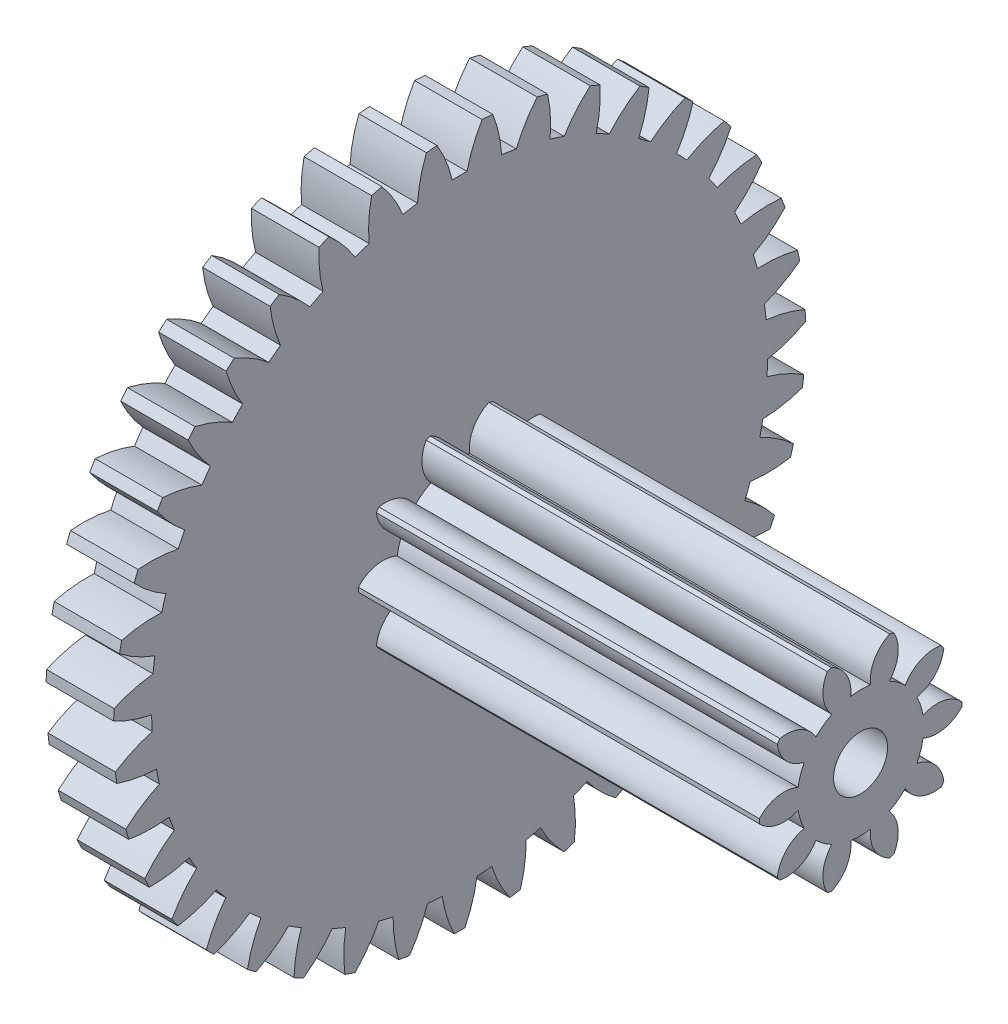
from build123d import *

# Parameters (mm, degrees)
ESQUISSE1_W                     = 1
ESQUISSE1_H                     = 5.125
ENL_V_MAT_EXTRU_1_DEPTH         = 8.316505313
ENL_V_MAT_EXTRU_2_DEPTH         = 8.316505313
ENL_V_MAT_EXTRU_3_DEPTH         = 8.316505313
ENL_V_MAT_EXTRU_4_DEPTH         = 8.316505313
ENL_V_MAT_EXTRU_5_DEPTH         = 8.316505313
ENL_V_MAT_EXTRU_6_DEPTH         = 8.316505313
ENL_V_MAT_EXTRU_7_DEPTH         = 8.316505313
ENL_V_MAT_EXTRU_8_DEPTH         = 8.316505313
ENL_V_MAT_EXTRU_9_DEPTH         = 8.316505313
ENL_V_MAT_EXTRU_10_DEPTH        = 8.316505313
ENL_V_MAT_EXTRU_11_DEPTH        = 8.316505313
ENL_V_MAT_EXTRU_12_DEPTH        = 8.316505313
ENL_V_MAT_EXTRU_13_DEPTH        = 8.316505313
ENL_V_MAT_EXTRU_14_DEPTH        = 8.316505313
ENL_V_MAT_EXTRU_15_DEPTH        = 8.316505313
ENL_V_MAT_EXTRU_16_DEPTH        = 8.316505313
ENL_V_MAT_EXTRU_17_DEPTH        = 8.316505313
ENL_V_MAT_EXTRU_18_DEPTH        = 8.316505313
ENL_V_MAT_EXTRU_19_DEPTH        = 8.316505313
ENL_V_MAT_EXTRU_20_DEPTH        = 8.316505313
ENL_V_MAT_EXTRU_21_DEPTH        = 8.316505313
ENL_V_MAT_EXTRU_22_DEPTH        = 8.316505313
ENL_V_MAT_EXTRU_23_DEPTH        = 8.316505313
ENL_V_MAT_EXTRU_24_DEPTH        = 8.316505313
ENL_V_MAT_EXTRU_25_DEPTH        = 8.316505313
ENL_V_MAT_EXTRU_26_DEPTH        = 8.316505313
ENL_V_MAT_EXTRU_27_DEPTH        = 8.316505313
ENL_V_MAT_EXTRU_28_DEPTH        = 8.316505313
ENL_V_MAT_EXTRU_29_DEPTH        = 8.316505313
ENL_V_MAT_EXTRU_30_DEPTH        = 8.316505313
ENL_V_MAT_EXTRU_31_DEPTH        = 8.316505313
ENL_V_MAT_EXTRU_32_DEPTH        = 8.315404959
ENL_V_MAT_EXTRU_33_DEPTH        = 8.315404959
ENL_V_MAT_EXTRU_34_DEPTH        = 8.315404959
ENL_V_MAT_EXTRU_35_DEPTH        = 8.315404959
ENL_V_MAT_EXTRU_36_DEPTH        = 8.315404959
ENL_V_MAT_EXTRU_37_DEPTH        = 8.315404959
ENL_V_MAT_EXTRU_38_DEPTH        = 8.315404959
ENL_V_MAT_EXTRU_39_DEPTH        = 8.315404959
BOSS_EXTRU_1_DEPTH              = 5.938524524
DIAM_TRE_DU_PER_AGE_0_8_0_8_1_D = 0.8


with BuildPart() as part:
    # Esquisse1 → Révolution1 (revolve)
    with BuildSketch(Plane(origin=(0, 0, 0), x_dir=(-1, 0, 0), z_dir=(0, 0, -1)), mode=Mode.PRIVATE) as r_volution1_sk:
        with Locations((-0.5, 2.5625)):
            Rectangle(ESQUISSE1_W, ESQUISSE1_H)
    revolve(r_volution1_sk.sketch.rotate(Axis((1, 0, 0), (-1, 0, 0)), 270), axis=Axis((1, 0, 0), (-1, 0, 0)))

    # Esquisse2 → Enlèv. mat.-Extru.1 (cut, through all)
    with BuildSketch(Plane.ZY):
        with BuildLine():
            ThreePointArc((-0.491599352, 5.101367961), (-0.822107814, 5.058632596), (-1.149140058, 4.994507196))
            ThreePointArc((-1.149140058, 4.994507196), (-0.974871828, 4.75090918), (-0.839964848, 4.483496549))
            ThreePointArc((-0.839964848, 4.483496549), (-0.731716058, 4.502429773), (-0.623042589, 4.518749847))
            ThreePointArc((-0.623042589, 4.518749847), (-0.579759423, 4.815121196), (-0.491599352, 5.101367961))
        make_face()
    extrude(amount=-ENL_V_MAT_EXTRU_1_DEPTH, mode=Mode.SUBTRACT)

    # Esquisse3 → Enlèv. mat.-Extru.2 (cut, through all)
    with BuildSketch(Plane.ZY):
        with BuildLine():
            ThreePointArc((0.3330837, 5.114164668), (0, 5.125), (-0.3330837, 5.114164668))
            ThreePointArc((-0.3330837, 5.114164668), (-0.200148067, 4.845766593), (-0.1098841, 4.560176283))
            ThreePointArc((-0.1098841, 4.560176283), (0, 4.5615), (0.1098841, 4.560176283))
            ThreePointArc((0.1098841, 4.560176283), (0.200148067, 4.845766593), (0.3330837, 5.114164668))
        make_face()
    extrude(amount=-ENL_V_MAT_EXTRU_2_DEPTH, mode=Mode.SUBTRACT)

    # Esquisse4 → Enlèv. mat.-Extru.3 (cut, through all)
    with BuildSketch(Plane.ZY):
        with BuildLine():
            ThreePointArc((1.149140058, 4.994507196), (0.822107814, 5.058632596), (0.491599352, 5.101367961))
            ThreePointArc((0.491599352, 5.101367961), (0.579759423, 4.815121196), (0.623042589, 4.518749847))
            ThreePointArc((0.623042589, 4.518749847), (0.731716058, 4.502429773), (0.839964848, 4.483496549))
            ThreePointArc((0.839964848, 4.483496549), (0.974871828, 4.75090918), (1.149140058, 4.994507196))
        make_face()
    extrude(amount=-ENL_V_MAT_EXTRU_3_DEPTH, mode=Mode.SUBTRACT)

    # Esquisse5 → Enlèv. mat.-Extru.4 (cut, through all)
    with BuildSketch(Plane.ZY):
        with BuildLine():
            ThreePointArc((1.935434293, 4.745494611), (1.622923468, 4.861249265), (1.303550238, 4.956448504))
            ThreePointArc((1.303550238, 4.956448504), (1.34465145, 4.65976669), (1.339832802, 4.360290164))
            ThreePointArc((1.339832802, 4.360290164), (1.444481054, 4.32674898), (1.548290948, 4.290696609))
            ThreePointArc((1.548290948, 4.290696609), (1.724346921, 4.533005716), (1.935434293, 4.745494611))
        make_face()
    extrude(amount=-ENL_V_MAT_EXTRU_4_DEPTH, mode=Mode.SUBTRACT)

    # Esquisse6 → Enlèv. mat.-Extru.5 (cut, through all)
    with BuildSketch(Plane.ZY):
        with BuildLine():
            ThreePointArc((2.671601796, 4.373576208), (2.381706257, 4.537962131), (2.081739858, 4.683159635))
            ThreePointArc((2.081739858, 4.683159635), (2.07471771, 4.383726673), (2.021922049, 4.088901256))
            ThreePointArc((2.021922049, 4.088901256), (2.119834749, 4.039007661), (2.216517126, 3.986769881))
            ThreePointArc((2.216517126, 3.986769881), (2.429162334, 4.197699784), (2.671601796, 4.373576208))
        make_face()
    extrude(amount=-ENL_V_MAT_EXTRU_5_DEPTH, mode=Mode.SUBTRACT)

    # Esquisse7 → Enlèv. mat.-Extru.6 (cut, through all)
    with BuildSketch(Plane.ZY):
        with BuildLine():
            ThreePointArc((3.338576216, 3.888384478), (3.078804104, 4.097144162), (2.806013509, 4.28857939))
            ThreePointArc((2.806013509, 4.28857939), (2.751049871, 3.994150439), (2.651644577, 3.711611952))
            ThreePointArc((2.651644577, 3.711611952), (2.740285838, 3.646658165), (2.827336674, 3.579587907))
            ThreePointArc((2.827336674, 3.579587907), (3.071063719, 3.753675633), (3.338576216, 3.888384478))
        make_face()
    extrude(amount=-ENL_V_MAT_EXTRU_6_DEPTH, mode=Mode.SUBTRACT)

    # Esquisse8 → Enlèv. mat.-Extru.7 (cut, through all)
    with BuildSketch(Plane.ZY):
        with BuildLine():
            ThreePointArc((3.919083265, 3.302485634), (3.696162543, 3.550212312), (3.457612884, 3.782927193))
            ThreePointArc((3.457612884, 3.782927193), (3.356131286, 3.501127806), (3.212690904, 3.23819385))
            ThreePointArc((3.212690904, 3.23819385), (3.289764964, 3.159862139), (3.364929688, 3.079696486))
            ThreePointArc((3.364929688, 3.079696486), (3.633426167, 3.212433254), (3.919083265, 3.302485634))
        make_face()
    extrude(amount=-ENL_V_MAT_EXTRU_7_DEPTH, mode=Mode.SUBTRACT)

    # Esquisse9 → Enlèv. mat.-Extru.8 (cut, through all)
    with BuildSketch(Plane.ZY):
        with BuildLine():
            ThreePointArc((4.398088117, 2.631054146), (4.217792313, 2.911331827), (4.019661902, 3.179299168))
            ThreePointArc((4.019661902, 3.179299168), (3.874290663, 2.917427803), (3.690530223, 2.680908227))
            ThreePointArc((3.690530223, 2.680908227), (3.754040904, 2.591227342), (3.81537279, 2.500042544))
            ThreePointArc((3.81537279, 2.500042544), (4.101684785, 2.587990542), (4.398088117, 2.631054146))
        make_face()
    extrude(amount=-ENL_V_MAT_EXTRU_8_DEPTH, mode=Mode.SUBTRACT)

    # Esquisse10 → Enlèv. mat.-Extru.9 (cut, through all)
    with BuildSketch(Plane.ZY):
        with BuildLine():
            ThreePointArc((4.763184796, 1.891479738), (4.630183477, 2.197049377), (4.477603787, 2.493328964))
            ThreePointArc((4.477603787, 2.493328964), (4.292107947, 2.258167951), (4.072786749, 2.054188489))
            ThreePointArc((4.072786749, 2.054188489), (4.121089157, 1.955481119), (4.166999741, 1.855638814))
            ThreePointArc((4.166999741, 1.855638814), (4.463711922, 1.896520234), (4.763184796, 1.891479738))
        make_face()
    extrude(amount=-ENL_V_MAT_EXTRU_9_DEPTH, mode=Mode.SUBTRACT)

    # Esquisse11 → Enlèv. mat.-Extru.10 (cut, through all)
    with BuildSketch(Plane.ZY):
        with BuildLine():
            ThreePointArc((5.004917491, 1.102916998), (4.922655322, 1.425864503), (4.819578087, 1.74278285))
            ThreePointArc((4.819578087, 1.74278285), (4.59876189, 1.540422736), (4.349560237, 1.374266349))
            ThreePointArc((4.349560237, 1.374266349), (4.381403366, 1.269088962), (4.410703588, 1.163175012))
            ThreePointArc((4.410703588, 1.163175012), (4.710131265, 1.155931048), (5.004917491, 1.102916998))
        make_face()
    extrude(amount=-ENL_V_MAT_EXTRU_10_DEPTH, mode=Mode.SUBTRACT)

    # Esquisse12 → Enlèv. mat.-Extru.11 (cut, through all)
    with BuildSketch(Plane.ZY):
        with BuildLine():
            ThreePointArc((5.117025453, 0.285789287), (5.08763298, 0.617750486), (5.036727846, 0.947099576))
            ThreePointArc((5.036727846, 0.947099576), (4.786310315, 0.782781381), (4.513682399, 0.658751432))
            ThreePointArc((4.513682399, 0.658751432), (4.528241529, 0.549828067), (4.540172528, 0.440585589))
            ThreePointArc((4.540172528, 0.440585589), (4.834560682, 0.385403856), (5.117025453, 0.285789287))
        make_face()
    extrude(amount=-ENL_V_MAT_EXTRU_11_DEPTH, mode=Mode.SUBTRACT)

    # Esquisse13 → Enlèv. mat.-Extru.12 (cut, through all)
    with BuildSketch(Plane.ZY):
        with BuildLine():
            ThreePointArc((5.096605143, -0.538740217), (5.120843616, -0.206362943), (5.123428999, 0.12688692))
            ThreePointArc((5.123428999, 0.12688692), (4.849895818, 0.0048664), (4.560902559, -0.073824801))
            ThreePointArc((4.560902559, -0.073824801), (4.557800615, -0.183673086), (4.552053385, -0.293414769))
            ThreePointArc((4.552053385, -0.293414769), (4.833777517, -0.395105094), (5.096605143, -0.538740217))
        make_face()
    extrude(amount=-ENL_V_MAT_EXTRU_12_DEPTH, mode=Mode.SUBTRACT)

    # Esquisse14 → Enlèv. mat.-Extru.13 (cut, through all)
    with BuildSketch(Plane.ZY):
        with BuildLine():
            ThreePointArc((4.944185436, -1.349316631), (5.021427092, -1.025131681), (5.077436033, -0.69661204))
            ThreePointArc((5.077436033, -0.69661204), (4.787871566, -0.773174619), (4.489997737, -0.804489011))
            ThreePointArc((4.489997737, -0.804489011), (4.469315059, -0.912417202), (4.446038451, -1.019815839))
            ThreePointArc((4.446038451, -1.019815839), (4.707802054, -1.16538103), (4.944185436, -1.349316631))
        make_face()
    extrude(amount=-ENL_V_MAT_EXTRU_13_DEPTH, mode=Mode.SUBTRACT)

    # Esquisse15 → Enlèv. mat.-Extru.14 (cut, through all)
    with BuildSketch(Plane.ZY):
        with BuildLine():
            ThreePointArc((4.663713924, -2.124946454), (4.791958244, -1.817350046), (4.89994014, -1.502069115))
            ThreePointArc((4.89994014, -1.502069115), (4.601843956, -1.531190821), (4.302804333, -1.514317378))
            ThreePointArc((4.302804333, -1.514317378), (4.265076591, -1.617530192), (4.224873456, -1.719804214))
            ThreePointArc((4.224873456, -1.719804214), (4.45989699, -1.905474209), (4.663713924, -2.124946454))
        make_face()
    extrude(amount=-ENL_V_MAT_EXTRU_14_DEPTH, mode=Mode.SUBTRACT)

    # Esquisse16 → Enlèv. mat.-Extru.15 (cut, through all)
    with BuildSketch(Plane.ZY):
        with BuildLine():
            ThreePointArc((4.262454672, -2.845541279), (4.438380194, -2.5625), (4.595538371, -2.268623388))
            ThreePointArc((4.595538371, -2.268623388), (4.296631004, -2.249549986), (4.004170557, -2.18492572))
            ThreePointArc((4.004170557, -2.18492572), (3.950374879, -2.28075), (3.894286457, -2.375250564))
            ThreePointArc((3.894286457, -2.375250564), (4.096482937, -2.596216607), (4.262454672, -2.845541279))
        make_face()
    extrude(amount=-ENL_V_MAT_EXTRU_15_DEPTH, mode=Mode.SUBTRACT)

    # Esquisse17 → Enlèv. mat.-Extru.16 (cut, through all)
    with BuildSketch(Plane.ZY):
        with BuildLine():
            ThreePointArc((3.750800082, -3.492438081), (3.969850429, -3.24128255), (4.172114573, -2.976421508))
            ThreePointArc((4.172114573, -2.976421508), (3.880137567, -2.909646987), (3.601830867, -2.798945633))
            ThreePointArc((3.601830867, -2.798945633), (3.533360533, -2.884899581), (3.462839485, -2.969179171))
            ThreePointArc((3.462839485, -2.969179171), (3.626972127, -3.219718359), (3.750800082, -3.492438081))
        make_face()
    extrude(amount=-ENL_V_MAT_EXTRU_16_DEPTH, mode=Mode.SUBTRACT)

    # Esquisse18 → Enlèv. mat.-Extru.17 (cut, through all)
    with BuildSketch(Plane.ZY):
        with BuildLine():
            ThreePointArc((3.14200174, -4.04888257), (3.398503623, -3.836117584), (3.640635198, -3.607131873))
            ThreePointArc((3.640635198, -3.607131873), (3.363150604, -3.49438566), (3.106205649, -3.340474325))
            ThreePointArc((3.106205649, -3.340474325), (3.024834006, -3.414331778), (2.941706789, -3.486207598))
            ThreePointArc((2.941706789, -3.486207598), (3.063524645, -3.759831097), (3.14200174, -4.04888257))
        make_face()
    extrude(amount=-ENL_V_MAT_EXTRU_17_DEPTH, mode=Mode.SUBTRACT)

    # Esquisse19 → Enlèv. mat.-Extru.18 (cut, through all)
    with BuildSketch(Plane.ZY):
        with BuildLine():
            ThreePointArc((2.451827203, -4.500463128), (2.739137359, -4.331599188), (3.014865285, -4.144419418))
            ThreePointArc((3.014865285, -4.144419418), (2.759059808, -3.988621579), (2.530131336, -3.795486487))
            ThreePointArc((2.530131336, -3.795486487), (2.437965866, -3.855334575), (2.344385433, -3.912945079))
            ThreePointArc((2.344385433, -3.912945079), (2.420733483, -4.202566184), (2.451827203, -4.500463128))
        make_face()
    extrude(amount=-ENL_V_MAT_EXTRU_18_DEPTH, mode=Mode.SUBTRACT)

    # Esquisse20 → Enlèv. mat.-Extru.19 (cut, through all)
    with BuildSketch(Plane.ZY):
        with BuildLine():
            ThreePointArc((1.69815163, -4.835484054), (2.008828876, -4.714894649), (2.311011944, -4.574368677))
            ThreePointArc((2.311011944, -4.574368677), (2.083510811, -4.379554295), (1.888527951, -4.152197542))
            ThreePointArc((1.888527951, -4.152197542), (1.787955691, -4.196486232), (1.686345725, -4.238339338))
            ThreePointArc((1.686345725, -4.238339338), (1.715246596, -4.536457014), (1.69815163, -4.835484054))
        make_face()
    extrude(amount=-ENL_V_MAT_EXTRU_19_DEPTH, mode=Mode.SUBTRACT)

    # Esquisse21 → Enlèv. mat.-Extru.20 (cut, through all)
    with BuildSketch(Plane.ZY):
        with BuildLine():
            ThreePointArc((0.900494822, -5.045268484), (1.226492779, -4.976076814), (1.547304608, -4.88584419))
            ThreePointArc((1.547304608, -4.88584419), (1.35399998, -4.657058855), (1.198012684, -4.401368862))
            ThreePointArc((1.198012684, -4.401368862), (1.091638403, -4.4289511), (0.984630549, -4.453962835))
            ThreePointArc((0.984630549, -4.453962835), (0.965335723, -4.75285599), (0.900494822, -5.045268484))
        make_face()
    extrude(amount=-ENL_V_MAT_EXTRU_20_DEPTH, mode=Mode.SUBTRACT)

    # Esquisse22 → Enlèv. mat.-Extru.21 (cut, through all)
    with BuildSketch(Plane.ZY):
        with BuildLine():
            ThreePointArc((0.079515671, -5.12438311), (0.412391165, -5.108381204), (0.743522895, -5.070778905))
            ThreePointArc((0.743522895, -5.070778905), (0.589421259, -4.813948037), (0.476469518, -4.53654704))
            ThreePointArc((0.476469518, -4.53654704), (0.367048253, -4.546708461), (0.257413959, -4.554231033))
            ThreePointArc((0.257413959, -4.554231033), (0.190423162, -4.846158493), (0.079515671, -5.12438311))
        make_face()
    extrude(amount=-ENL_V_MAT_EXTRU_21_DEPTH, mode=Mode.SUBTRACT)

    # Esquisse23 → Enlèv. mat.-Extru.22 (cut, through all)
    with BuildSketch(Plane.ZY):
        with BuildLine():
            ThreePointArc((-0.743522895, -5.070778905), (-0.412391165, -5.108381204), (-0.079515671, -5.12438311))
            ThreePointArc((-0.079515671, -5.12438311), (-0.190423162, -4.846158493), (-0.257413959, -4.554231033))
            ThreePointArc((-0.257413959, -4.554231033), (-0.367048253, -4.546708461), (-0.476469518, -4.53654704))
            ThreePointArc((-0.476469518, -4.53654704), (-0.589421259, -4.813948037), (-0.743522895, -5.070778905))
        make_face()
    extrude(amount=-ENL_V_MAT_EXTRU_22_DEPTH, mode=Mode.SUBTRACT)

    # Esquisse24 → Enlèv. mat.-Extru.23 (cut, through all)
    with BuildSketch(Plane.ZY):
        with BuildLine():
            ThreePointArc((-1.547304608, -4.88584419), (-1.226492779, -4.976076814), (-0.900494822, -5.045268484))
            ThreePointArc((-0.900494822, -5.045268484), (-0.965335723, -4.75285599), (-0.984630549, -4.453962835))
            ThreePointArc((-0.984630549, -4.453962835), (-1.091638403, -4.4289511), (-1.198012684, -4.401368862))
            ThreePointArc((-1.198012684, -4.401368862), (-1.35399998, -4.657058855), (-1.547304608, -4.88584419))
        make_face()
    extrude(amount=-ENL_V_MAT_EXTRU_23_DEPTH, mode=Mode.SUBTRACT)

    # Esquisse25 → Enlèv. mat.-Extru.24 (cut, through all)
    with BuildSketch(Plane.ZY):
        with BuildLine():
            ThreePointArc((-2.311011944, -4.574368677), (-2.008828876, -4.714894649), (-1.69815163, -4.835484054))
            ThreePointArc((-1.69815163, -4.835484054), (-1.715246596, -4.536457014), (-1.686345725, -4.238339338))
            ThreePointArc((-1.686345725, -4.238339338), (-1.787955691, -4.196486232), (-1.888527951, -4.152197542))
            ThreePointArc((-1.888527951, -4.152197542), (-2.083510811, -4.379554295), (-2.311011944, -4.574368677))
        make_face()
    extrude(amount=-ENL_V_MAT_EXTRU_24_DEPTH, mode=Mode.SUBTRACT)

    # Esquisse26 → Enlèv. mat.-Extru.25 (cut, through all)
    with BuildSketch(Plane.ZY):
        with BuildLine():
            ThreePointArc((-3.014865285, -4.144419418), (-2.739137359, -4.331599188), (-2.451827203, -4.500463128))
            ThreePointArc((-2.451827203, -4.500463128), (-2.420733483, -4.202566184), (-2.344385433, -3.912945079))
            ThreePointArc((-2.344385433, -3.912945079), (-2.437965866, -3.855334575), (-2.530131336, -3.795486487))
            ThreePointArc((-2.530131336, -3.795486487), (-2.759059808, -3.988621579), (-3.014865285, -4.144419418))
        make_face()
    extrude(amount=-ENL_V_MAT_EXTRU_25_DEPTH, mode=Mode.SUBTRACT)

    # Esquisse27 → Enlèv. mat.-Extru.26 (cut, through all)
    with BuildSketch(Plane.ZY):
        with BuildLine():
            ThreePointArc((-3.640635198, -3.607131873), (-3.398503623, -3.836117584), (-3.14200174, -4.04888257))
            ThreePointArc((-3.14200174, -4.04888257), (-3.063524645, -3.759831097), (-2.941706789, -3.486207598))
            ThreePointArc((-2.941706789, -3.486207598), (-3.024834006, -3.414331778), (-3.106205649, -3.340474325))
            ThreePointArc((-3.106205649, -3.340474325), (-3.363150604, -3.49438566), (-3.640635198, -3.607131873))
        make_face()
    extrude(amount=-ENL_V_MAT_EXTRU_26_DEPTH, mode=Mode.SUBTRACT)

    # Esquisse28 → Enlèv. mat.-Extru.27 (cut, through all)
    with BuildSketch(Plane.ZY):
        with BuildLine():
            ThreePointArc((-4.172114573, -2.976421508), (-3.969850429, -3.24128255), (-3.750800082, -3.492438081))
            ThreePointArc((-3.750800082, -3.492438081), (-3.626972127, -3.219718359), (-3.462839485, -2.969179171))
            ThreePointArc((-3.462839485, -2.969179171), (-3.533360533, -2.884899581), (-3.601830867, -2.798945633))
            ThreePointArc((-3.601830867, -2.798945633), (-3.880137567, -2.909646987), (-4.172114573, -2.976421508))
        make_face()
    extrude(amount=-ENL_V_MAT_EXTRU_27_DEPTH, mode=Mode.SUBTRACT)

    # Esquisse29 → Enlèv. mat.-Extru.28 (cut, through all)
    with BuildSketch(Plane.ZY):
        with BuildLine():
            ThreePointArc((-4.595538371, -2.268623388), (-4.438380194, -2.5625), (-4.262454672, -2.845541279))
            ThreePointArc((-4.262454672, -2.845541279), (-4.096482937, -2.596216607), (-3.894286457, -2.375250564))
            ThreePointArc((-3.894286457, -2.375250564), (-3.950374879, -2.28075), (-4.004170557, -2.18492572))
            ThreePointArc((-4.004170557, -2.18492572), (-4.296631004, -2.249549986), (-4.595538371, -2.268623388))
        make_face()
    extrude(amount=-ENL_V_MAT_EXTRU_28_DEPTH, mode=Mode.SUBTRACT)

    # Esquisse30 → Enlèv. mat.-Extru.29 (cut, through all)
    with BuildSketch(Plane.ZY):
        with BuildLine():
            ThreePointArc((-4.89994014, -1.502069115), (-4.791958244, -1.817350046), (-4.663713924, -2.124946454))
            ThreePointArc((-4.663713924, -2.124946454), (-4.45989699, -1.905474209), (-4.224873456, -1.719804214))
            ThreePointArc((-4.224873456, -1.719804214), (-4.265076591, -1.617530192), (-4.302804333, -1.514317378))
            ThreePointArc((-4.302804333, -1.514317378), (-4.601843956, -1.531190821), (-4.89994014, -1.502069115))
        make_face()
    extrude(amount=-ENL_V_MAT_EXTRU_29_DEPTH, mode=Mode.SUBTRACT)

    # Esquisse31 → Enlèv. mat.-Extru.30 (cut, through all)
    with BuildSketch(Plane.ZY):
        with BuildLine():
            ThreePointArc((-5.077436033, -0.69661204), (-5.021427092, -1.025131681), (-4.944185436, -1.349316631))
            ThreePointArc((-4.944185436, -1.349316631), (-4.707802054, -1.16538103), (-4.446038451, -1.019815839))
            ThreePointArc((-4.446038451, -1.019815839), (-4.469315059, -0.912417202), (-4.489997737, -0.804489011))
            ThreePointArc((-4.489997737, -0.804489011), (-4.787871566, -0.773174619), (-5.077436033, -0.69661204))
        make_face()
    extrude(amount=-ENL_V_MAT_EXTRU_30_DEPTH, mode=Mode.SUBTRACT)

    # Esquisse32 → Enlèv. mat.-Extru.31 (cut, through all)
    with BuildSketch(Plane.ZY):
        with BuildLine():
            ThreePointArc((-5.123428999, 0.12688692), (-5.120843616, -0.206362943), (-5.096605143, -0.538740217))
            ThreePointArc((-5.096605143, -0.538740217), (-4.833777517, -0.395105094), (-4.552053385, -0.293414769))
            ThreePointArc((-4.552053385, -0.293414769), (-4.557800615, -0.183673086), (-4.560902559, -0.073824801))
            ThreePointArc((-4.560902559, -0.073824801), (-4.849895818, 0.0048664), (-5.123428999, 0.12688692))
        make_face()
    extrude(amount=-ENL_V_MAT_EXTRU_31_DEPTH, mode=Mode.SUBTRACT)

    # Esquisse33 → Enlèv. mat.-Extru.32 (cut, through all)
    with BuildSketch(Plane.ZY):
        with BuildLine():
            ThreePointArc((-5.036727846, 0.947099576), (-5.08763298, 0.617750486), (-5.117025453, 0.285789287))
            ThreePointArc((-5.117025453, 0.285789287), (-4.834560682, 0.385403856), (-4.540172528, 0.440585589))
            ThreePointArc((-4.540172528, 0.440585589), (-4.528241529, 0.549828067), (-4.513682399, 0.658751432))
            ThreePointArc((-4.513682399, 0.658751432), (-4.786310315, 0.782781381), (-5.036727846, 0.947099576))
        make_face()
    extrude(amount=-ENL_V_MAT_EXTRU_32_DEPTH, mode=Mode.SUBTRACT)

    # Esquisse34 → Enlèv. mat.-Extru.33 (cut, through all)
    with BuildSketch(Plane.ZY):
        with BuildLine():
            ThreePointArc((-4.819578087, 1.74278285), (-4.922655322, 1.425864503), (-5.004917491, 1.102916998))
            ThreePointArc((-5.004917491, 1.102916998), (-4.710131265, 1.155931048), (-4.410703588, 1.163175012))
            ThreePointArc((-4.410703588, 1.163175012), (-4.381403366, 1.269088962), (-4.349560237, 1.374266349))
            ThreePointArc((-4.349560237, 1.374266349), (-4.59876189, 1.540422736), (-4.819578087, 1.74278285))
        make_face()
    extrude(amount=-ENL_V_MAT_EXTRU_33_DEPTH, mode=Mode.SUBTRACT)

    # Esquisse35 → Enlèv. mat.-Extru.34 (cut, through all)
    with BuildSketch(Plane.ZY):
        with BuildLine():
            ThreePointArc((-4.477603787, 2.493328964), (-4.630183477, 2.197049377), (-4.763184796, 1.891479738))
            ThreePointArc((-4.763184796, 1.891479738), (-4.463711922, 1.896520234), (-4.166999741, 1.855638814))
            ThreePointArc((-4.166999741, 1.855638814), (-4.121089157, 1.955481119), (-4.072786749, 2.054188489))
            ThreePointArc((-4.072786749, 2.054188489), (-4.292107947, 2.258167951), (-4.477603787, 2.493328964))
        make_face()
    extrude(amount=-ENL_V_MAT_EXTRU_34_DEPTH, mode=Mode.SUBTRACT)

    # Esquisse36 → Enlèv. mat.-Extru.35 (cut, through all)
    with BuildSketch(Plane.ZY):
        with BuildLine():
            ThreePointArc((-4.019661902, 3.179299168), (-4.217792313, 2.911331827), (-4.398088117, 2.631054146))
            ThreePointArc((-4.398088117, 2.631054146), (-4.101684785, 2.587990542), (-3.81537279, 2.500042544))
            ThreePointArc((-3.81537279, 2.500042544), (-3.754040904, 2.591227342), (-3.690530223, 2.680908227))
            ThreePointArc((-3.690530223, 2.680908227), (-3.874290663, 2.917427803), (-4.019661902, 3.179299168))
        make_face()
    extrude(amount=-ENL_V_MAT_EXTRU_35_DEPTH, mode=Mode.SUBTRACT)

    # Esquisse37 → Enlèv. mat.-Extru.36 (cut, through all)
    with BuildSketch(Plane.ZY):
        with BuildLine():
            ThreePointArc((-3.457612884, 3.782927193), (-3.696162543, 3.550212312), (-3.919083265, 3.302485634))
            ThreePointArc((-3.919083265, 3.302485634), (-3.633426167, 3.212433254), (-3.364929688, 3.079696486))
            ThreePointArc((-3.364929688, 3.079696486), (-3.289764964, 3.159862139), (-3.212690904, 3.23819385))
            ThreePointArc((-3.212690904, 3.23819385), (-3.356131286, 3.501127806), (-3.457612884, 3.782927193))
        make_face()
    extrude(amount=-ENL_V_MAT_EXTRU_36_DEPTH, mode=Mode.SUBTRACT)

    # Esquisse38 → Enlèv. mat.-Extru.37 (cut, through all)
    with BuildSketch(Plane.ZY):
        with BuildLine():
            ThreePointArc((-2.806013509, 4.28857939), (-3.078804104, 4.097144162), (-3.338576216, 3.888384478))
            ThreePointArc((-3.338576216, 3.888384478), (-3.071063719, 3.753675633), (-2.827336674, 3.579587907))
            ThreePointArc((-2.827336674, 3.579587907), (-2.740285838, 3.646658165), (-2.651644577, 3.711611952))
            ThreePointArc((-2.651644577, 3.711611952), (-2.751049871, 3.994150439), (-2.806013509, 4.28857939))
        make_face()
    extrude(amount=-ENL_V_MAT_EXTRU_37_DEPTH, mode=Mode.SUBTRACT)

    # Esquisse39 → Enlèv. mat.-Extru.38 (cut, through all)
    with BuildSketch(Plane.ZY):
        with BuildLine():
            ThreePointArc((-2.081739858, 4.683159635), (-2.381706257, 4.537962131), (-2.671601796, 4.373576208))
            ThreePointArc((-2.671601796, 4.373576208), (-2.429162334, 4.197699784), (-2.216517126, 3.986769881))
            ThreePointArc((-2.216517126, 3.986769881), (-2.119834749, 4.039007661), (-2.021922049, 4.088901256))
            ThreePointArc((-2.021922049, 4.088901256), (-2.07471771, 4.383726673), (-2.081739858, 4.683159635))
        make_face()
    extrude(amount=-ENL_V_MAT_EXTRU_38_DEPTH, mode=Mode.SUBTRACT)

    # Esquisse40 → Enlèv. mat.-Extru.39 (cut, through all)
    with BuildSketch(Plane.ZY):
        with BuildLine():
            ThreePointArc((-1.303550238, 4.956448504), (-1.622923468, 4.861249265), (-1.935434293, 4.745494611))
            ThreePointArc((-1.935434293, 4.745494611), (-1.724346921, 4.533005716), (-1.548290948, 4.290696609))
            ThreePointArc((-1.548290948, 4.290696609), (-1.444481054, 4.32674898), (-1.339832802, 4.360290164))
            ThreePointArc((-1.339832802, 4.360290164), (-1.34465145, 4.65976669), (-1.303550238, 4.956448504))
        make_face()
    extrude(amount=-ENL_V_MAT_EXTRU_39_DEPTH, mode=Mode.SUBTRACT)

    # Esquisse41 → Boss.-Extru.1 (add)
    with BuildSketch(Plane(origin=(1, 0, 0), x_dir=(0, 0, -1), z_dir=(1, 0, 0))):
        with BuildLine():
            ThreePointArc((0.662076845, 0.662334131), (0.888221597, 0.871258232), (1.193891961, 0.908086992))
            ThreePointArc((1.193891961, 0.908086992), (1.213525492, 0.881677878), (1.232574957, 0.854844416))
            ThreePointArc((1.232574957, 0.854844416), (1.103091387, 0.575515338), (0.834510188, 0.424999995))
            ThreePointArc((0.834510188, 0.424999995), (0.890664428, 0.289394415), (0.924941654, 0.146680563))
            ThreePointArc((0.924941654, 0.146680563), (1.230699107, 0.18277916), (1.499639028, 0.032905721))
            ThreePointArc((1.499639028, 0.032905721), (1.5, 0), (1.499639028, -0.032905721))
            ThreePointArc((1.499639028, -0.032905721), (1.230699107, -0.18277916), (0.924941654, -0.146680563))
            ThreePointArc((0.924941654, -0.146680563), (0.890664428, -0.289394415), (0.834510188, -0.424999995))
            ThreePointArc((0.834510188, -0.424999995), (1.103091387, -0.575515338), (1.232574957, -0.854844416))
            ThreePointArc((1.232574957, -0.854844416), (1.213525492, -0.881677878), (1.193891961, -0.908086992))
            ThreePointArc((1.193891961, -0.908086992), (0.888221597, -0.871258232), (0.662076845, -0.662334131))
            ThreePointArc((0.662076845, -0.662334131), (0.550460889, -0.757644415), (0.425324195, -0.834345))
            ThreePointArc((0.425324195, -0.834345), (0.55414025, -1.113982538), (0.494709146, -1.416073042))
            ThreePointArc((0.494709146, -1.416073042), (0.463525492, -1.426584774), (0.432118744, -1.436409897))
            ThreePointArc((0.432118744, -1.436409897), (0.206473627, -1.226946272), (0.146321185, -0.924998573))
            ThreePointArc((0.146321185, -0.924998573), (0, -0.9365), (-0.146321185, -0.924998573))
            ThreePointArc((-0.146321185, -0.924998573), (-0.206473627, -1.226946272), (-0.432118744, -1.436409897))
            ThreePointArc((-0.432118744, -1.436409897), (-0.463525492, -1.426584774), (-0.494709146, -1.416073042))
            ThreePointArc((-0.494709146, -1.416073042), (-0.55414025, -1.113982538), (-0.425324195, -0.834345))
            ThreePointArc((-0.425324195, -0.834345), (-0.550460889, -0.757644415), (-0.662076845, -0.662334131))
            ThreePointArc((-0.662076845, -0.662334131), (-0.888221597, -0.871258232), (-1.193891961, -0.908086992))
            ThreePointArc((-1.193891961, -0.908086992), (-1.213525492, -0.881677878), (-1.232574957, -0.854844416))
            ThreePointArc((-1.232574957, -0.854844416), (-1.103091387, -0.575515338), (-0.834510188, -0.424999995))
            ThreePointArc((-0.834510188, -0.424999995), (-0.890664428, -0.289394415), (-0.924941654, -0.146680563))
            ThreePointArc((-0.924941654, -0.146680563), (-1.230699107, -0.18277916), (-1.499639028, -0.032905721))
            ThreePointArc((-1.499639028, -0.032905721), (-1.5, 0), (-1.499639028, 0.032905721))
            ThreePointArc((-1.499639028, 0.032905721), (-1.230699107, 0.18277916), (-0.924941654, 0.146680563))
            ThreePointArc((-0.924941654, 0.146680563), (-0.890664428, 0.289394415), (-0.834510188, 0.424999995))
            ThreePointArc((-0.834510188, 0.424999995), (-1.103091387, 0.575515338), (-1.232574957, 0.854844416))
            ThreePointArc((-1.232574957, 0.854844416), (-1.213525492, 0.881677878), (-1.193891961, 0.908086992))
            ThreePointArc((-1.193891961, 0.908086992), (-0.888221597, 0.871258232), (-0.662076845, 0.662334131))
            ThreePointArc((-0.662076845, 0.662334131), (-0.550460889, 0.757644415), (-0.425324195, 0.834345))
            ThreePointArc((-0.425324195, 0.834345), (-0.55414025, 1.113982538), (-0.494709146, 1.416073042))
            ThreePointArc((-0.494709146, 1.416073042), (-0.463525492, 1.426584774), (-0.432118744, 1.436409897))
            ThreePointArc((-0.432118744, 1.436409897), (-0.206473627, 1.226946272), (-0.146321185, 0.924998573))
            ThreePointArc((-0.146321185, 0.924998573), (0, 0.9365), (0.146321185, 0.924998573))
            ThreePointArc((0.146321185, 0.924998573), (0.206473627, 1.226946272), (0.432118744, 1.436409897))
            ThreePointArc((0.432118744, 1.436409897), (0.463525492, 1.426584774), (0.494709146, 1.416073042))
            ThreePointArc((0.494709146, 1.416073042), (0.55414025, 1.113982538), (0.425324195, 0.834345))
            ThreePointArc((0.425324195, 0.834345), (0.550460889, 0.757644415), (0.662076845, 0.662334131))
        make_face()
    extrude(amount=BOSS_EXTRU_1_DEPTH)

    # Diamètre du perçage Ø0.8 (0.8)1 (through all)
    with Locations(Plane.ZY):
        with Locations((0, 0)):
            Hole(DIAM_TRE_DU_PER_AGE_0_8_0_8_1_D / 2)


solid = part.part
